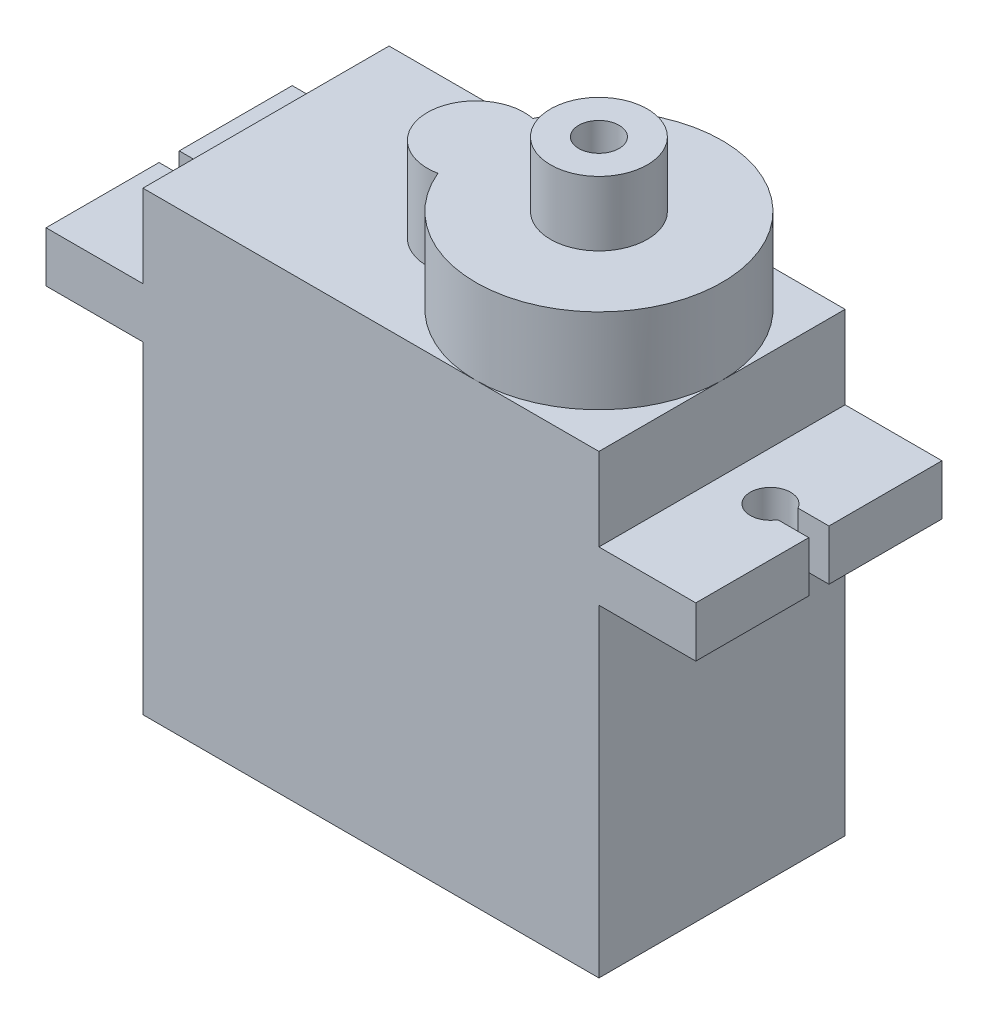
from build123d import *

# Parameters (mm, degrees)
SKETCH1_W           = 22.6
SKETCH1_H           = 12.2
BOSS_EXTRUDE1_DEPTH = 22.6
SKETCH4_W           = 12.2
SKETCH4_H           = 2.5
BOSS_EXTRUDE2_DEPTH = 4.8
SKETCH5_W           = 12.2
SKETCH5_H           = 2.5
BOSS_EXTRUDE3_DEPTH = 4.8
BOSS_EXTRUDE4_DEPTH = 4.2
SKETCH9_R           = 2.4
BOSS_EXTRUDE5_DEPTH = 3.2
SKETCH10_R          = 1
CUT_EXTRUDE1_DEPTH  = 3.2
CUT_EXTRUDE2_DEPTH  = 26.271921177
CUT_EXTRUDE3_DEPTH  = 26.271921177


with BuildPart() as part:
    # Sketch1 → Boss-Extrude1 (new body)
    with BuildSketch(Plane(origin=(0, 0, 0), x_dir=(1, 0, 0), z_dir=(0, 1, 0))):
        Rectangle(SKETCH1_W, SKETCH1_H)
    extrude(amount=BOSS_EXTRUDE1_DEPTH)

    # Sketch4 → Boss-Extrude2 (add)
    with BuildSketch(Plane.ZY.offset(11.3)):
        with Locations((0, 17.25)):
            Rectangle(SKETCH4_W, SKETCH4_H)
    extrude(amount=BOSS_EXTRUDE2_DEPTH)

    # Sketch5 → Boss-Extrude3 (add)
    with BuildSketch(Plane(origin=(11.3, 0, 0), x_dir=(0, 0, -1), z_dir=(1, 0, 0))):
        with Locations((0, 17.25)):
            Rectangle(SKETCH5_W, SKETCH5_H)
    extrude(amount=BOSS_EXTRUDE3_DEPTH)

    # Sketch8 → Boss-Extrude4 (add)
    with BuildSketch(Plane(origin=(0, 22.6, 0), x_dir=(1, 0, 0), z_dir=(0, 1, 0))):
        with BuildLine():
            ThreePointArc((-0.427868852, -2.353102671), (11.3, 0), (-0.427868852, 2.353102671))
            ThreePointArc((-0.427868852, 2.353102671), (-3.3, 0), (-0.427868852, -2.353102671))
        make_face()
    extrude(amount=BOSS_EXTRUDE4_DEPTH)

    # Sketch9 → Boss-Extrude5 (add)
    with BuildSketch(Plane(origin=(0, 26.8, 0), x_dir=(1, 0, 0), z_dir=(0, 1, 0))):
        with Locations(Location((5.2, 0, 0), (0, 0, 270))):
            Circle(SKETCH9_R)
    extrude(amount=BOSS_EXTRUDE5_DEPTH)

    # Sketch10 → Cut-Extrude1 (cut)
    with BuildSketch(Plane(origin=(0, 30, 0), x_dir=(1, 0, 0), z_dir=(0, 1, 0))):
        with Locations(Location((5.2, 0, 0), (0, 0, 270))):
            Circle(SKETCH10_R)
    extrude(amount=-CUT_EXTRUDE1_DEPTH, mode=Mode.SUBTRACT)

    # Sketch12 → Cut-Extrude2 (cut, through all)
    with BuildSketch(Plane(origin=(0, 18.5, 0), x_dir=(1, 0, 0), z_dir=(0, 1, 0))):
        with BuildLine():
            Line((16.1, 0.5), (16.1, -0.5))
            Line((16.1, -0.5), (14.566025404, -0.5))
            ThreePointArc((14.566025404, -0.5), (12.7, 0), (14.566025404, 0.5))
            Line((14.566025404, 0.5), (16.1, 0.5))
        make_face()
    extrude(amount=-CUT_EXTRUDE2_DEPTH, mode=Mode.SUBTRACT)

    # Sketch13 → Cut-Extrude3 (cut, through all)
    with BuildSketch(Plane(origin=(0, 18.5, 0), x_dir=(1, 0, 0), z_dir=(0, 1, 0))):
        with BuildLine():
            Line((-16.1, 0.5), (-16.1, -0.5))
            Line((-16.1, -0.5), (-14.566025404, -0.5))
            ThreePointArc((-14.566025404, -0.5), (-12.7, 0), (-14.566025404, 0.5))
            Line((-14.566025404, 0.5), (-16.1, 0.5))
        make_face()
    extrude(amount=-CUT_EXTRUDE3_DEPTH, mode=Mode.SUBTRACT)


solid = part.part
